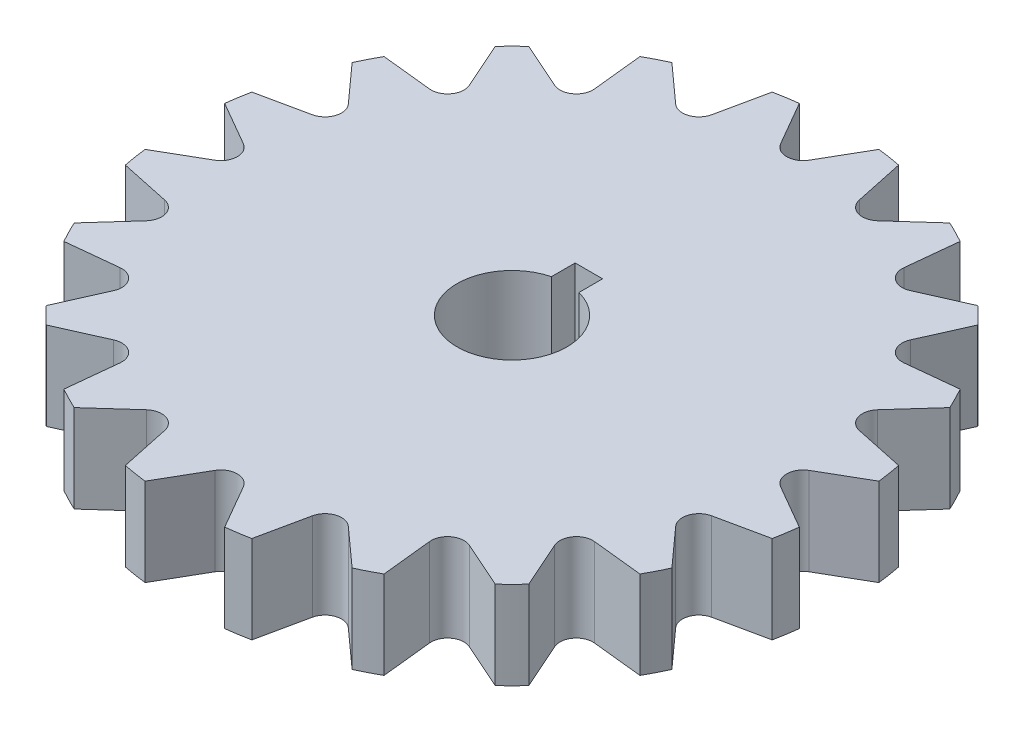
from build123d import *

# Parameters (mm, degrees)
BOSS_EXTRUDE1_DEPTH = 8


with BuildPart() as part:
    # Sketch1 → Boss-Extrude1 (new body)
    with BuildSketch(Plane(origin=(0, 0, 0), x_dir=(1, 0, 0), z_dir=(0, 1, 0))):
        with BuildLine():
            ThreePointArc((5.756768163, 29.44247986), (4.693033951, 29.630650218), (3.62321476, 29.780401522))
            Line((3.62321476, 29.780401522), (1.299038106, 25.754809472))
            ThreePointArc((1.299038106, 25.754809472), (0, 25.004809472), (-1.299038106, 25.754809472))
            Line((-1.299038106, 25.754809472), (-3.62321476, 29.780401522))
            ThreePointArc((-3.62321476, 29.780401522), (-4.693033951, 29.630650218), (-5.756768163, 29.44247986))
            Line((-5.756768163, 29.44247986), (-6.723215158, 24.895704225))
            ThreePointArc((-6.723215158, 24.895704225), (-7.726911068, 23.780986987), (-9.194132469, 24.092854523))
            Line((-9.194132469, 24.092854523), (-12.648532177, 27.20320999))
            ThreePointArc((-12.648532177, 27.20320999), (-13.619714992, 26.730195726), (-14.573238507, 26.222523132))
            Line((-14.573238507, 26.222523132), (-14.087353279, 21.59963399))
            ThreePointArc((-14.087353279, 21.59963399), (-14.697458244, 20.229315804), (-16.189241087, 20.072523109))
            Line((-16.189241087, 20.072523109), (-20.435723137, 21.963178729))
            ThreePointArc((-20.435723137, 21.963178729), (-21.213203436, 21.213203436), (-21.963178729, 20.435723137))
            Line((-21.963178729, 20.435723137), (-20.072523109, 16.189241087))
            ThreePointArc((-20.072523109, 16.189241087), (-20.229315804, 14.697458244), (-21.59963399, 14.087353279))
            Line((-21.59963399, 14.087353279), (-26.222523132, 14.573238507))
            ThreePointArc((-26.222523132, 14.573238507), (-26.730195726, 13.619714992), (-27.20320999, 12.648532177))
            Line((-27.20320999, 12.648532177), (-24.092854523, 9.194132469))
            ThreePointArc((-24.092854523, 9.194132469), (-23.780986987, 7.726911068), (-24.895704225, 6.723215158))
            Line((-24.895704225, 6.723215158), (-29.44247986, 5.756768163))
            ThreePointArc((-29.44247986, 5.756768163), (-29.630650218, 4.693033951), (-29.780401522, 3.62321476))
            Line((-29.780401522, 3.62321476), (-25.754809472, 1.299038106))
            ThreePointArc((-25.754809472, 1.299038106), (-25.004809472, 0), (-25.754809472, -1.299038106))
            Line((-25.754809472, -1.299038106), (-29.780401522, -3.62321476))
            ThreePointArc((-29.780401522, -3.62321476), (-29.630650218, -4.693033951), (-29.44247986, -5.756768163))
            Line((-29.44247986, -5.756768163), (-24.895704225, -6.723215158))
            ThreePointArc((-24.895704225, -6.723215158), (-23.780986987, -7.726911068), (-24.092854523, -9.194132469))
            Line((-24.092854523, -9.194132469), (-27.20320999, -12.648532177))
            ThreePointArc((-27.20320999, -12.648532177), (-26.730195726, -13.619714992), (-26.222523132, -14.573238507))
            Line((-26.222523132, -14.573238507), (-21.59963399, -14.087353279))
            ThreePointArc((-21.59963399, -14.087353279), (-20.229315804, -14.697458244), (-20.072523109, -16.189241087))
            Line((-20.072523109, -16.189241087), (-21.963178729, -20.435723137))
            ThreePointArc((-21.963178729, -20.435723137), (-21.213203436, -21.213203436), (-20.435723137, -21.963178729))
            Line((-20.435723137, -21.963178729), (-16.189241087, -20.072523109))
            ThreePointArc((-16.189241087, -20.072523109), (-14.697458244, -20.229315804), (-14.087353279, -21.59963399))
            Line((-14.087353279, -21.59963399), (-14.573238507, -26.222523132))
            ThreePointArc((-14.573238507, -26.222523132), (-13.619714992, -26.730195726), (-12.648532177, -27.20320999))
            Line((-12.648532177, -27.20320999), (-9.194132469, -24.092854523))
            ThreePointArc((-9.194132469, -24.092854523), (-7.726911068, -23.780986987), (-6.723215158, -24.895704225))
            Line((-6.723215158, -24.895704225), (-5.756768163, -29.44247986))
            ThreePointArc((-5.756768163, -29.44247986), (-4.693033951, -29.630650218), (-3.62321476, -29.780401522))
            Line((-3.62321476, -29.780401522), (-1.299038106, -25.754809472))
            ThreePointArc((-1.299038106, -25.754809472), (0, -25.004809472), (1.299038106, -25.754809472))
            Line((1.299038106, -25.754809472), (3.62321476, -29.780401522))
            ThreePointArc((3.62321476, -29.780401522), (4.693033951, -29.630650218), (5.756768163, -29.44247986))
            Line((5.756768163, -29.44247986), (6.723215158, -24.895704225))
            ThreePointArc((6.723215158, -24.895704225), (7.726911068, -23.780986987), (9.194132469, -24.092854523))
            Line((9.194132469, -24.092854523), (12.648532177, -27.20320999))
            ThreePointArc((12.648532177, -27.20320999), (13.619714992, -26.730195726), (14.573238507, -26.222523132))
            Line((14.573238507, -26.222523132), (14.087353279, -21.59963399))
            ThreePointArc((14.087353279, -21.59963399), (14.697458244, -20.229315804), (16.189241087, -20.072523109))
            Line((16.189241087, -20.072523109), (20.435723137, -21.963178729))
            ThreePointArc((20.435723137, -21.963178729), (21.213203436, -21.213203436), (21.963178729, -20.435723137))
            Line((21.963178729, -20.435723137), (20.072523109, -16.189241087))
            ThreePointArc((20.072523109, -16.189241087), (20.229315804, -14.697458244), (21.59963399, -14.087353279))
            Line((21.59963399, -14.087353279), (26.222523132, -14.573238507))
            ThreePointArc((26.222523132, -14.573238507), (26.730195726, -13.619714992), (27.20320999, -12.648532177))
            Line((27.20320999, -12.648532177), (24.092854523, -9.194132469))
            ThreePointArc((24.092854523, -9.194132469), (23.780986987, -7.726911068), (24.895704225, -6.723215158))
            Line((24.895704225, -6.723215158), (29.44247986, -5.756768163))
            ThreePointArc((29.44247986, -5.756768163), (29.630650218, -4.693033951), (29.780401522, -3.62321476))
            Line((29.780401522, -3.62321476), (25.754809472, -1.299038106))
            ThreePointArc((25.754809472, -1.299038106), (25.004809472, 0), (25.754809472, 1.299038106))
            Line((25.754809472, 1.299038106), (29.780401522, 3.62321476))
            ThreePointArc((29.780401522, 3.62321476), (29.630650218, 4.693033951), (29.44247986, 5.756768163))
            Line((29.44247986, 5.756768163), (24.895704225, 6.723215158))
            ThreePointArc((24.895704225, 6.723215158), (23.780986987, 7.726911068), (24.092854523, 9.194132469))
            Line((24.092854523, 9.194132469), (27.20320999, 12.648532177))
            ThreePointArc((27.20320999, 12.648532177), (26.730195726, 13.619714992), (26.222523132, 14.573238507))
            Line((26.222523132, 14.573238507), (21.59963399, 14.087353279))
            ThreePointArc((21.59963399, 14.087353279), (20.229315804, 14.697458244), (20.072523109, 16.189241087))
            Line((20.072523109, 16.189241087), (21.963178729, 20.435723137))
            ThreePointArc((21.963178729, 20.435723137), (21.213203436, 21.213203436), (20.435723137, 21.963178729))
            Line((20.435723137, 21.963178729), (16.189241087, 20.072523109))
            ThreePointArc((16.189241087, 20.072523109), (14.697458244, 20.229315804), (14.087353279, 21.59963399))
            Line((14.087353279, 21.59963399), (14.573238507, 26.222523132))
            ThreePointArc((14.573238507, 26.222523132), (13.619714992, 26.730195726), (12.648532177, 27.20320999))
            Line((12.648532177, 27.20320999), (9.194132469, 24.092854523))
            ThreePointArc((9.194132469, 24.092854523), (7.726911068, 23.780986987), (6.723215158, 24.895704225))
            Line((6.723215158, 24.895704225), (5.756768163, 29.44247986))
        make_face()
        with BuildLine():
            ThreePointArc((5, 0), (-3.061862178, -3.952847075), (-1.25, 4.841229183))
            Line((-1.25, 4.841229183), (-1.25, 7))
            Line((-1.25, 7), (1.25, 7))
            Line((1.25, 7), (1.25, 4.841229183))
            ThreePointArc((1.25, 4.841229183), (3.952847075, 3.061862178), (5, 0))
        make_face(mode=Mode.SUBTRACT)
    extrude(amount=BOSS_EXTRUDE1_DEPTH)


solid = part.part
